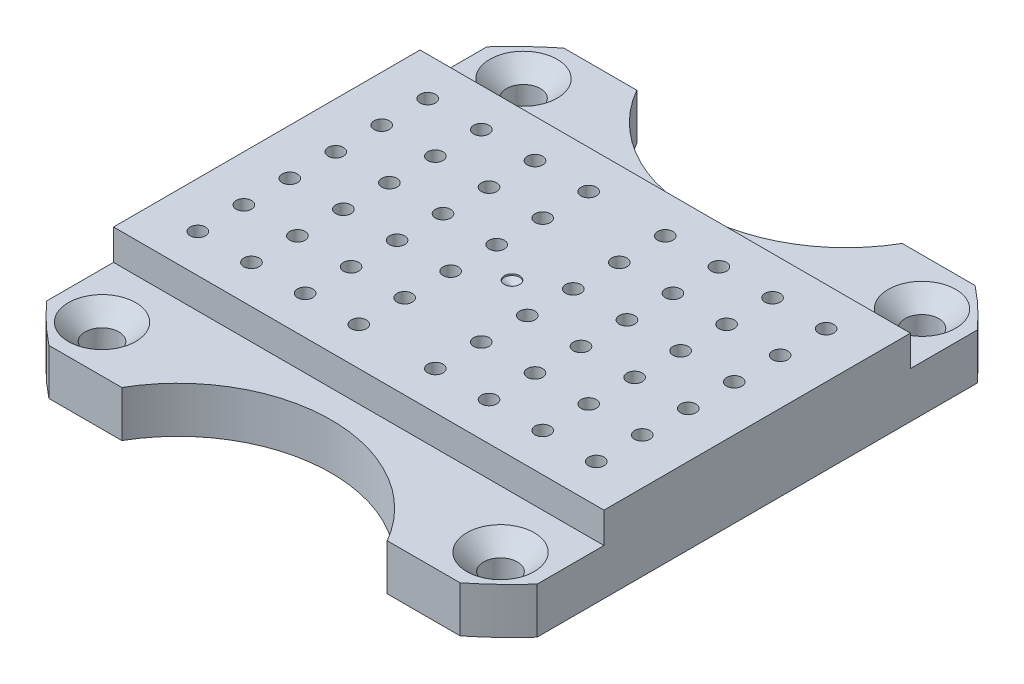
from build123d import *

# Parameters (mm, degrees)
SKIZZE1_W                                            = 32
SKIZZE1_H                                            = 33.6
AUFSATZ_LINEAR_AUSTRAGEN1_DEPTH                      = 5
SKIZZE9_R                                            = 0.5
SCHNITT_LINEAR_AUSTRAGEN1_DEPTH                      = 6
SKIZZE10_W                                           = 32
SKIZZE10_H                                           = 6.8
SCHNITT_LINEAR_AUSTRAGEN2_DEPTH                      = 2
FORMSENKUNG_F_R_M2_LINSENSENKSCHRAUBE_MI_D           = 2.2
FORMSENKUNG_F_R_M2_LINSENSENKSCHRAUBE_MI_DEPTH       = 4
FORMSENKUNG_F_R_M2_LINSENSENKSCHRAUBE_MI_CSINK_D     = 4.4
FORMSENKUNG_F_R_M2_LINSENSENKSCHRAUBE_MI_CSINK_ANGLE = 90
FORMSENKUNG_F_R_M2_LINSENSENKSCHRAUBE_MI_TIP         = 0.660946681
SKIZZE13_R                                           = 10
SCHNITT_LINEAR_AUSTRAGEN3_DEPTH                      = 24.393161394
SKIZZE14_R                                           = 31.5
SKIZZE14_R_2                                         = 21.5
SCHNITT_LINEAR_AUSTRAGEN_D_NN1_DEPTH                 = 10
F_1_0_1_DURCHMESSER_BOHRUNG1_D                       = 1
F_1_0_1_DURCHMESSER_BOHRUNG1_DEPTH                   = 0.1
F_1_0_1_DURCHMESSER_BOHRUNG1_TIP                     = 0.30043031


with BuildPart() as part:
    # Skizze1 → Aufsatz-Linear austragen1 (new body)
    with BuildSketch(Plane(origin=(0, 0, 0), x_dir=(1, 0, 0), z_dir=(0, 1, 0))):
        Rectangle(SKIZZE1_W, SKIZZE1_H)
    extrude(amount=AUFSATZ_LINEAR_AUSTRAGEN1_DEPTH)

    # Skizze9 → Schnitt-Linear austragen1 (cut)
    with BuildSketch(Plane(origin=(0, 5, 0), x_dir=(1, 0, 0), z_dir=(0, 1, 0))):
        with Locations(Location((-13, 7.5, 0), (0, 0, 270))):
            Circle(SKIZZE9_R)
        with Locations(Location((-9.5, 7.5, 0), (0, 0, 270))):
            Circle(SKIZZE9_R)
        with Locations(Location((-6, 7.5, 0), (0, 0, 270))):
            Circle(SKIZZE9_R)
        with Locations(Location((-2.5, 7.5, 0), (0, 0, 270))):
            Circle(SKIZZE9_R)
        with Locations(Location((-2.5, 4.5, 0), (0, 0, 270))):
            Circle(SKIZZE9_R)
        with Locations(Location((13, -7.5, 0), (0, 0, 270))):
            Circle(SKIZZE9_R)
        with Locations(Location((13, -4.5, 0), (0, 0, 270))):
            Circle(SKIZZE9_R)
        with Locations(Location((13, -1.5, 0), (0, 0, 270))):
            Circle(SKIZZE9_R)
        with Locations(Location((13, 1.5, 0), (0, 0, 270))):
            Circle(SKIZZE9_R)
        with Locations(Location((13, 4.5, 0), (0, 0, 270))):
            Circle(SKIZZE9_R)
        with Locations(Location((-2.5, 1.5, 0), (0, 0, 270))):
            Circle(SKIZZE9_R)
        with Locations(Location((-9.5, 4.5, 0), (0, 0, 270))):
            Circle(SKIZZE9_R)
        with Locations(Location((-6, 4.5, 0), (0, 0, 270))):
            Circle(SKIZZE9_R)
        with Locations(Location((-2.5, -1.5, 0), (0, 0, 270))):
            Circle(SKIZZE9_R)
        with Locations(Location((-2.5, -4.5, 0), (0, 0, 270))):
            Circle(SKIZZE9_R)
        with Locations(Location((-2.5, -7.5, 0), (0, 0, 270))):
            Circle(SKIZZE9_R)
        with Locations(Location((6, -7.5, 0), (0, 0, 270))):
            Circle(SKIZZE9_R)
        with Locations(Location((9.5, -7.5, 0), (0, 0, 270))):
            Circle(SKIZZE9_R)
        with Locations(Location((2.5, -7.5, 0), (0, 0, 270))):
            Circle(SKIZZE9_R)
        with Locations(Location((2.5, -4.5, 0), (0, 0, 270))):
            Circle(SKIZZE9_R)
        with Locations(Location((6, -4.5, 0), (0, 0, 270))):
            Circle(SKIZZE9_R)
        with Locations(Location((-9.5, 1.5, 0), (0, 0, 270))):
            Circle(SKIZZE9_R)
        with Locations(Location((-6, 1.5, 0), (0, 0, 270))):
            Circle(SKIZZE9_R)
        with Locations(Location((2.5, -1.5, 0), (0, 0, 270))):
            Circle(SKIZZE9_R)
        with Locations(Location((2.5, 1.5, 0), (0, 0, 270))):
            Circle(SKIZZE9_R)
        with Locations(Location((9.5, -4.5, 0), (0, 0, 270))):
            Circle(SKIZZE9_R)
        with Locations(Location((2.5, 4.5, 0), (0, 0, 270))):
            Circle(SKIZZE9_R)
        with Locations(Location((2.5, 7.5, 0), (0, 0, 270))):
            Circle(SKIZZE9_R)
        with Locations(Location((6, -1.5, 0), (0, 0, 270))):
            Circle(SKIZZE9_R)
        with Locations(Location((9.5, -1.5, 0), (0, 0, 270))):
            Circle(SKIZZE9_R)
        with Locations(Location((-9.5, -1.5, 0), (0, 0, 270))):
            Circle(SKIZZE9_R)
        with Locations(Location((-6, -1.5, 0), (0, 0, 270))):
            Circle(SKIZZE9_R)
        with Locations(Location((6, 1.5, 0), (0, 0, 270))):
            Circle(SKIZZE9_R)
        with Locations(Location((9.5, 1.5, 0), (0, 0, 270))):
            Circle(SKIZZE9_R)
        with Locations(Location((6, 4.5, 0), (0, 0, 270))):
            Circle(SKIZZE9_R)
        with Locations(Location((-9.5, -4.5, 0), (0, 0, 270))):
            Circle(SKIZZE9_R)
        with Locations(Location((-6, -4.5, 0), (0, 0, 270))):
            Circle(SKIZZE9_R)
        with Locations(Location((9.5, 4.5, 0), (0, 0, 270))):
            Circle(SKIZZE9_R)
        with Locations(Location((6, 7.5, 0), (0, 0, 270))):
            Circle(SKIZZE9_R)
        with Locations(Location((9.5, 7.5, 0), (0, 0, 270))):
            Circle(SKIZZE9_R)
        with Locations(Location((13, 7.5, 0), (0, 0, 270))):
            Circle(SKIZZE9_R)
        with Locations(Location((-9.5, -7.5, 0), (0, 0, 270))):
            Circle(SKIZZE9_R)
        with Locations(Location((-6, -7.5, 0), (0, 0, 270))):
            Circle(SKIZZE9_R)
        with Locations(Location((-13, 4.5, 0), (0, 0, 270))):
            Circle(SKIZZE9_R)
        with Locations(Location((-13, 1.5, 0), (0, 0, 270))):
            Circle(SKIZZE9_R)
        with Locations(Location((-13, -1.5, 0), (0, 0, 270))):
            Circle(SKIZZE9_R)
        with Locations(Location((-13, -4.5, 0), (0, 0, 270))):
            Circle(SKIZZE9_R)
        with Locations(Location((-13, -7.5, 0), (0, 0, 270))):
            Circle(SKIZZE9_R)
    extrude(amount=-SCHNITT_LINEAR_AUSTRAGEN1_DEPTH, mode=Mode.SUBTRACT)

    # Skizze10 → Schnitt-Linear austragen2 (cut)
    with BuildSketch(Plane(origin=(0, 5, 0), x_dir=(1, 0, 0), z_dir=(0, 1, 0))):
        with Locations((0, 13.4)):
            Rectangle(SKIZZE10_W, SKIZZE10_H)
        with Locations((0, -13.4)):
            Rectangle(SKIZZE10_W, SKIZZE10_H)
    extrude(amount=-SCHNITT_LINEAR_AUSTRAGEN2_DEPTH, mode=Mode.SUBTRACT)

    # Formsenkung für M2 Linsensenkschraube mit Schlitz2
    with Locations(Plane(origin=(0, 3, 0), x_dir=(1, 0, 0), z_dir=(0, 1, 0))):
        with Locations((-13, 13.75), (13, 13.75), (13, -13.75), (-13, -13.75)):
            CounterSinkHole(FORMSENKUNG_F_R_M2_LINSENSENKSCHRAUBE_MI_D / 2, FORMSENKUNG_F_R_M2_LINSENSENKSCHRAUBE_MI_CSINK_D / 2, depth=FORMSENKUNG_F_R_M2_LINSENSENKSCHRAUBE_MI_DEPTH, counter_sink_angle=FORMSENKUNG_F_R_M2_LINSENSENKSCHRAUBE_MI_CSINK_ANGLE)
            with Locations((0, 0, -(FORMSENKUNG_F_R_M2_LINSENSENKSCHRAUBE_MI_DEPTH + FORMSENKUNG_F_R_M2_LINSENSENKSCHRAUBE_MI_TIP / 2))):  # 118° drill point
                Cone(0, FORMSENKUNG_F_R_M2_LINSENSENKSCHRAUBE_MI_D / 2, FORMSENKUNG_F_R_M2_LINSENSENKSCHRAUBE_MI_TIP, mode=Mode.SUBTRACT)

    # Skizze13 → Schnitt-Linear austragen3 (cut, through all)
    with BuildSketch(Plane(origin=(0, 3, 0), x_dir=(1, 0, 0), z_dir=(0, 1, 0))):
        with Locations((0, 21.8)):
            Circle(SKIZZE13_R)
    schnitt_linear_austragen3 = extrude(amount=-SCHNITT_LINEAR_AUSTRAGEN3_DEPTH, mode=Mode.SUBTRACT)

    # Spiegeln3: Schnitt-Linear austragen3 across plane
    add(schnitt_linear_austragen3.mirror(Plane.XY), mode=Mode.SUBTRACT)

    # Skizze14 → Schnitt-Linear-Austragen-Dünn1 (cut)
    with BuildSketch(Plane(origin=(0, 5, 0), x_dir=(1, 0, 0), z_dir=(0, 1, 0))):
        Circle(SKIZZE14_R)
        Circle(SKIZZE14_R_2, mode=Mode.SUBTRACT)
    extrude(amount=-SCHNITT_LINEAR_AUSTRAGEN_D_NN1_DEPTH, mode=Mode.SUBTRACT)

    # Ø1.0 (1) Durchmesser Bohrung1
    with Locations(Plane(origin=(0, 5, 0), x_dir=(1, 0, 0), z_dir=(0, 1, 0))):
        with Locations((0, 0)):
            Hole(F_1_0_1_DURCHMESSER_BOHRUNG1_D / 2, depth=F_1_0_1_DURCHMESSER_BOHRUNG1_DEPTH)
            with Locations((0, 0, -(F_1_0_1_DURCHMESSER_BOHRUNG1_DEPTH + F_1_0_1_DURCHMESSER_BOHRUNG1_TIP / 2))):  # 118° drill point
                Cone(0, F_1_0_1_DURCHMESSER_BOHRUNG1_D / 2, F_1_0_1_DURCHMESSER_BOHRUNG1_TIP, mode=Mode.SUBTRACT)


solid = part.part
